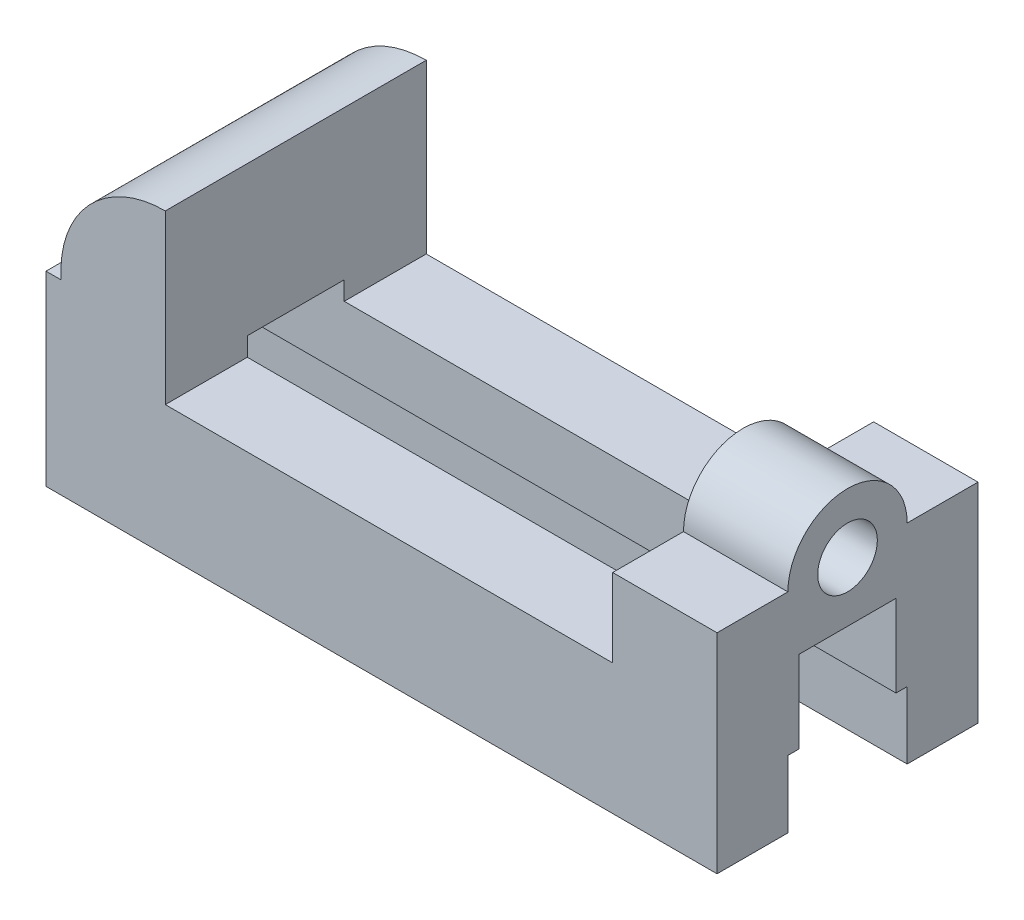
from build123d import *

# Parameters (mm, degrees)
BOSS_EXTRUDE1_DEPTH = 35
CUT_EXTRUDE1_DEPTH  = 201.062490237
SKETCH3_R           = 16
SKETCH3_R_2         = 8
BOSS_EXTRUDE2_DEPTH = 28
CUT_EXTRUDE2_REACH  = 202.062
SKETCH3_2_R         = 8


with BuildPart() as part:
    # Sketch1 → Boss-Extrude1 (new, symmetric)
    with BuildSketch(Plane.XY):
        with BuildLine():
            Line((0, 0), (180, 0))
            Line((180, 0), (180, 56))
            Line((180, 56), (152, 56))
            Line((152, 56), (152, 35))
            Line((152, 35), (32, 35))
            Line((32, 35), (32, 80))
            ThreePointArc((32, 80), (11.506098468, 71.078784028), (4.071519912, 50))
            Line((4.071519912, 50), (0, 50))
            Line((0, 50), (0, 0))
        make_face()
    extrude(amount=BOSS_EXTRUDE1_DEPTH, both=True)

    # Sketch2 → Cut-Extrude1 (cut, through all)
    with BuildSketch(Plane.ZY):
        Polygon((-16, 0), (-16, 18), (-13, 18), (-13, 40), (13, 40), (13, 18), (16, 18), (16, 0), align=None)
    extrude(amount=-CUT_EXTRUDE1_DEPTH, mode=Mode.SUBTRACT)

    # Sketch3 → Boss-Extrude2 (add)
    with BuildSketch(Plane(origin=(180, 0, 0), x_dir=(0, 0, -1), z_dir=(1, 0, 0))):
        with Locations((0, 56)):
            Circle(SKETCH3_R)
        with Locations((0, 56)):
            Circle(SKETCH3_R_2, mode=Mode.SUBTRACT)
    extrude(amount=-BOSS_EXTRUDE2_DEPTH)

    # Sketch3<2> → Cut-Extrude2 (cut, up to next)
    with BuildSketch(Plane(origin=(180, 0, 0), x_dir=(0, 0, -1), z_dir=(1, 0, 0)), mode=Mode.PRIVATE) as cut_extrude2_sk1:
        with Locations((0, 56)):
            Circle(SKETCH3_2_R)
    cut_extrude2_tool1 = extrude(cut_extrude2_sk1.sketch, amount=-CUT_EXTRUDE2_REACH, mode=Mode.PRIVATE) & part.part
    add(cut_extrude2_tool1.solids().sort_by_distance((180, 56, 0))[0], mode=Mode.SUBTRACT)


solid = part.part
